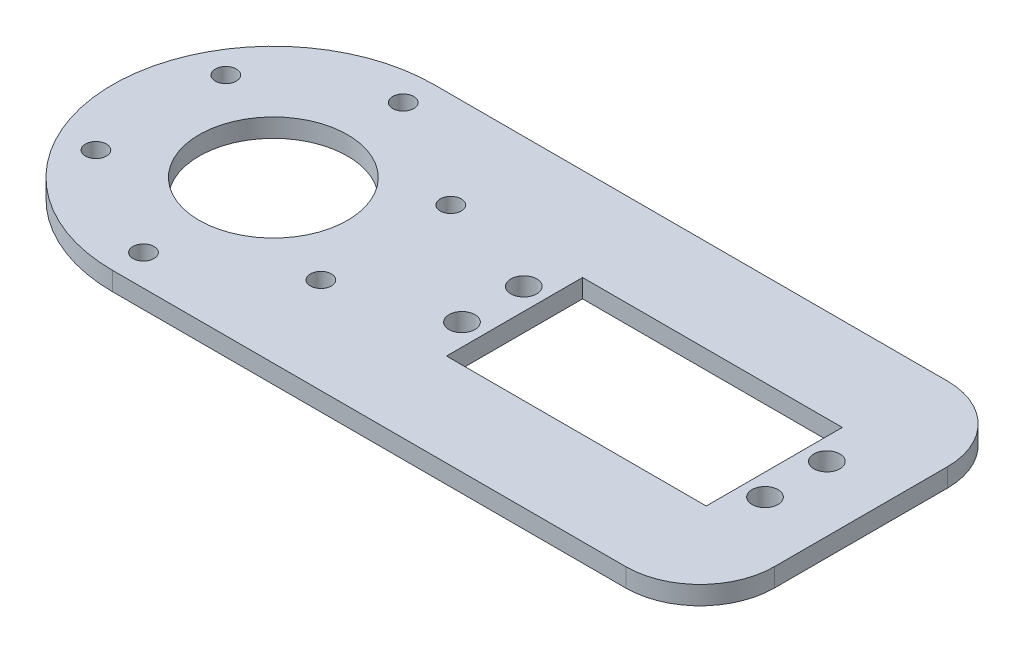
from build123d import *

# Parameters (mm, degrees)
SKETCH_1_R      = 12
SKETCH_1_R_2    = 1.7
SKETCH_1_R_3    = 2.1
SKETCH_1_W      = 42
SKETCH_1_H      = 22
EXTRUDE_1_DEPTH = 3
FILLET_1_R      = 12


with BuildPart() as part:
    # 草图1 → 凸台-拉伸1 (new body)
    with BuildSketch(Plane(origin=(0, 0, 0), x_dir=(1, 0, 0), z_dir=(0, 1, 0))):
        with BuildLine():
            Line((0, -26), (95, -26))
            Line((95, -26), (95, 26))
            Line((95, 26), (0, 26))
            ThreePointArc((0, 26), (-26, 0), (0, -26))
        make_face()
        with Locations(Location((0, 0, 0), (0, 0, 270))):
            Circle(SKETCH_1_R, mode=Mode.SUBTRACT)
        with Locations(Location((0, -21, 0), (0, 0, 270))):
            Circle(SKETCH_1_R_2, mode=Mode.SUBTRACT)
        with Locations(Location((35.5, 5, 0), (0, 0, 270))):
            Circle(SKETCH_1_R_3, mode=Mode.SUBTRACT)
        with Locations(Location((35.5, -5, 0), (0, 0, 270))):
            Circle(SKETCH_1_R_3, mode=Mode.SUBTRACT)
        with Locations(Location((84.5, -5, 0), (0, 0, 90))):
            Circle(SKETCH_1_R_3, mode=Mode.SUBTRACT)
        with Locations(Location((84.5, 5, 0), (0, 0, 90))):
            Circle(SKETCH_1_R_3, mode=Mode.SUBTRACT)
        with Locations(Location((-18.186533479, -10.5, 0), (0, 0, 270))):
            Circle(SKETCH_1_R_2, mode=Mode.SUBTRACT)
        with Locations(Location((-18.186533479, 10.5, 0), (0, 0, 270))):
            Circle(SKETCH_1_R_2, mode=Mode.SUBTRACT)
        with Locations(Location((0, 21, 0), (0, 0, 270))):
            Circle(SKETCH_1_R_2, mode=Mode.SUBTRACT)
        with Locations(Location((18.186533479, 10.5, 0), (0, 0, 270))):
            Circle(SKETCH_1_R_2, mode=Mode.SUBTRACT)
        with Locations(Location((18.186533479, -10.5, 0), (0, 0, 270))):
            Circle(SKETCH_1_R_2, mode=Mode.SUBTRACT)
        with Locations((60, 0)):
            Rectangle(SKETCH_1_W, SKETCH_1_H, mode=Mode.SUBTRACT)
    extrude(amount=EXTRUDE_1_DEPTH)

    # 圆角1
    fillet_1_edges = [part.edges().sort_by_distance(p)[0] for p in [
        (95, 1.5, -26),
        (95, 1.5, 26),
    ]]
    fillet(fillet_1_edges, radius=FILLET_1_R)


solid = part.part
